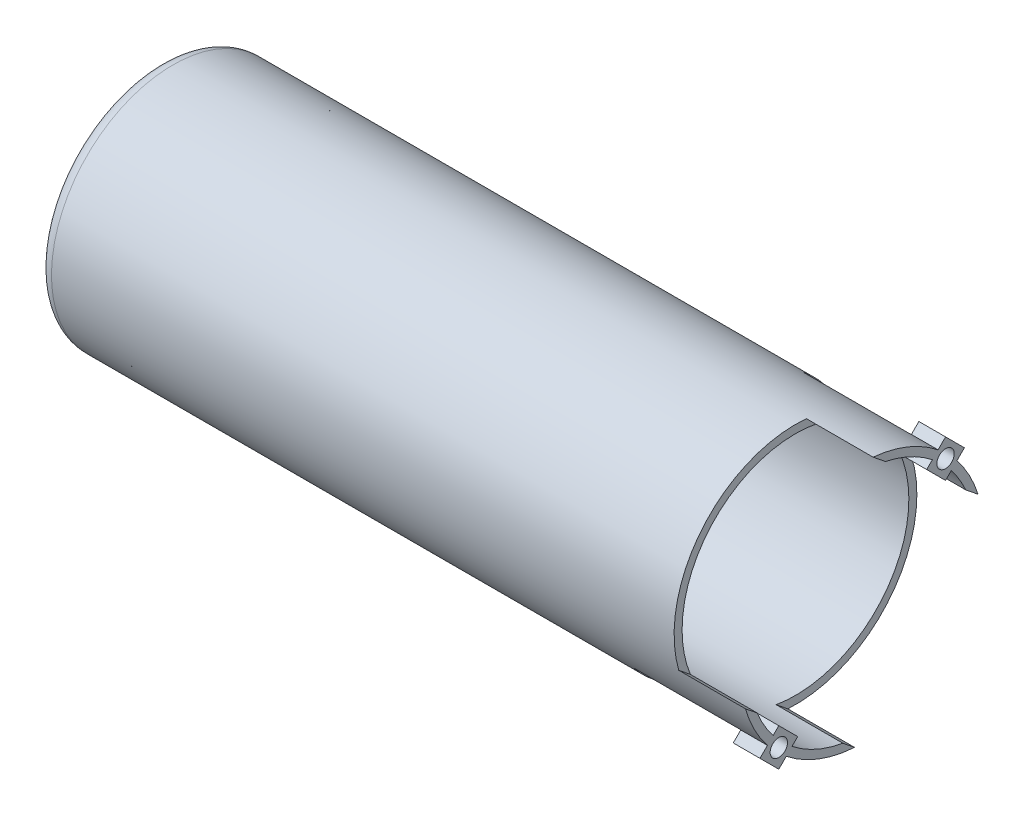
from build123d import *

# Parameters (mm, degrees)
FILLET1_R           = 1
SKETCH3_R           = 5.5
CUT_EXTRUDE1_DEPTH  = 0.35
CUT_EXTRUDE2_DEPTH  = 5
BOSS_EXTRUDE2_DEPTH = 2
SKETCH5_R           = 0.65
CUT_EXTRUDE3_DEPTH  = 5
SKETCH7_R           = 1.1
CUT_EXTRUDE4_DEPTH  = 8


with BuildPart() as part:
    # Sketch1 → Revolve1 (revolve)
    with BuildSketch(Plane.XY, mode=Mode.PRIVATE) as revolve1_sk:
        Polygon((-17.325922144, -3.94739572), (34.674077856, -3.94739572), (34.674077856, -4.54739572), (-17.825922144, -4.54739572), (-18.531230067, -0.94739572), (-18.531230067, 0.05260428), (-18.031230067, 0.05260428), align=None)
    revolve(revolve1_sk.sketch.rotate(Axis((-18.92728318, 4.55260428, 0), (1, 0, 0)), 270), axis=Axis((-18.92728318, 4.55260428, 0), (1, 0, 0)))

    # Fillet1
    fillet1_edges = [part.edges().sort_by_distance(p)[0] for p in [
        (-17.825922144, 4.55260428, -9.1),
    ]]
    fillet(fillet1_edges, radius=FILLET1_R)

    # Sketch3 → Cut-Extrude1 (cut)
    with BuildSketch(Plane.ZY.offset(18.531230067)):
        with Locations((0, 4.55260428)):
            Circle(SKETCH3_R)
    extrude(amount=-CUT_EXTRUDE1_DEPTH, mode=Mode.SUBTRACT)

    # Sketch4 → Cut-Extrude2 (cut)
    with BuildSketch(Plane(origin=(34.674077856, 0, 0), x_dir=(0, 0, -1), z_dir=(1, 0, 0))):
        Polygon((-13.628095951, 5.995190129), (5.056342646, -9.067736356), (14.470671699, 2.610037767), (-4.213766898, 17.672964252), align=None)
    extrude(amount=-CUT_EXTRUDE2_DEPTH, mode=Mode.SUBTRACT)

    # Sketch6 → Boss-Extrude2 (add)
    with BuildSketch(Plane(origin=(34.674077856, 0, 0), x_dir=(0, 0, -1), z_dir=(1, 0, 0))):
        Polygon((-6.25, -0.283182158), (-4.835786438, -1.69739572), (-6.25, -3.111609282), (-7.664213562, -1.69739572), align=None)
        Polygon((4.835786438, 10.80260428), (6.25, 12.216817842), (7.664213562, 10.80260428), (6.25, 9.388390718), align=None)
    extrude(amount=-BOSS_EXTRUDE2_DEPTH)

    # Sketch5 → Cut-Extrude3 (cut)
    with BuildSketch(Plane(origin=(34.674077856, 0, 0), x_dir=(0, 0, -1), z_dir=(1, 0, 0))):
        with Locations((6.25, 10.80260428)):
            Circle(SKETCH5_R)
        with Locations((-6.25, -1.69739572)):
            Circle(SKETCH5_R)
    extrude(amount=-CUT_EXTRUDE3_DEPTH, mode=Mode.SUBTRACT)

    # Sketch7 → Cut-Extrude4 (cut)
    with BuildSketch(Plane.ZY.offset(-32.674077856)):
        with Locations((6.25, -1.69739572)):
            Circle(SKETCH7_R)
        with Locations((-6.25, 10.80260428)):
            Circle(SKETCH7_R)
    extrude(amount=CUT_EXTRUDE4_DEPTH, mode=Mode.SUBTRACT)


solid = part.part
